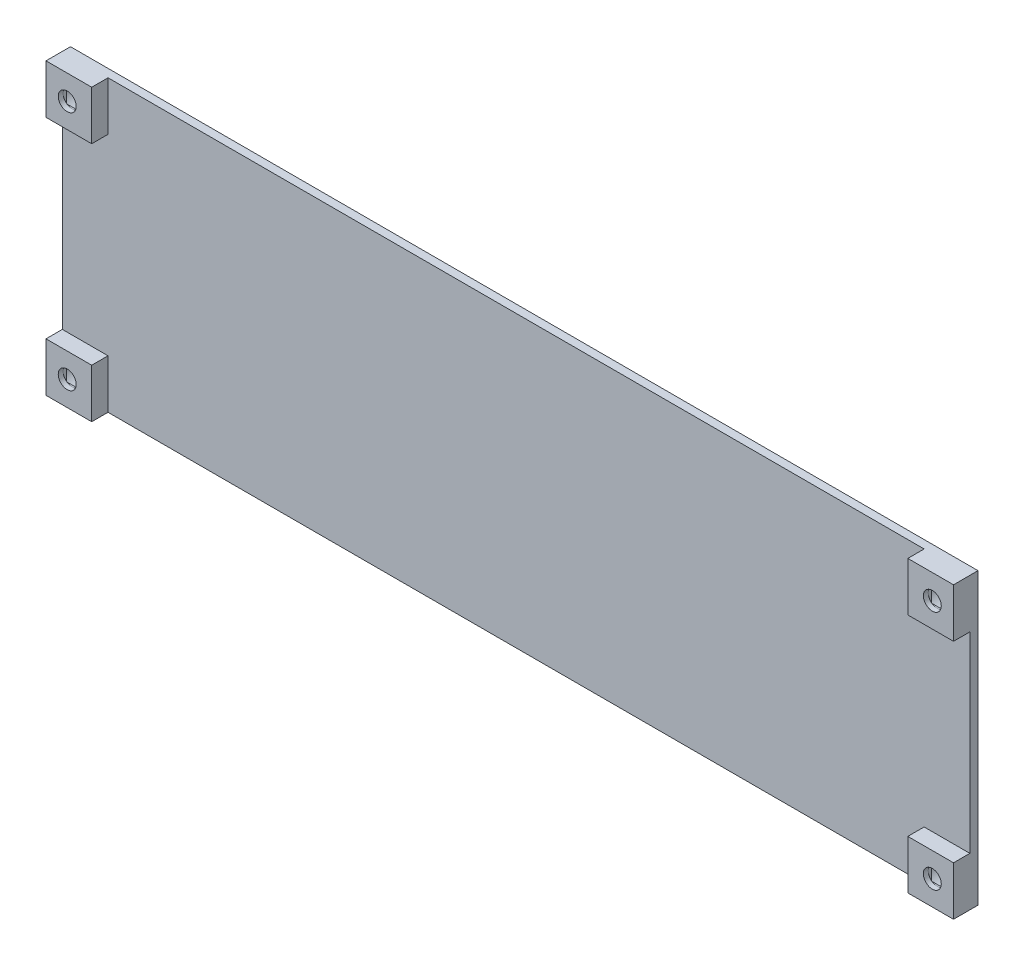
from build123d import *
from build123d.topology import SkipClean

# Parameters (mm, degrees)
SKETCH1_W               = 112
SKETCH1_H               = 35.5
BOSS_EXTRUDE1_DEPTH     = 1
SKETCH2_W               = 6
SKETCH2_H               = 6
BOSS_EXTRUDE2_DEPTH     = 2
SKETCH3_R               = 1.1
CUT_EXTRUDE1_DEPTH      = 59.822295943
SKETCH4_R               = 2
CUT_EXTRUDE2_DEPTH      = 2
CUT_EXTRUDE3_DEPTH      = 0.2
SKETCH6_W               = 2.2
SKETCH6_H               = 2.2
CUT_EXTRUDE4_DEPTH      = 0.2
MIRROR2_COPY_1_DEPTH    = 0.2
MIRROR2_COPY_2_SKETCH_W = 2.2
MIRROR2_COPY_2_SKETCH_H = 2.2
MIRROR2_COPY_2_DEPTH    = 0.2
SKETCH7_W               = 0.4
SKETCH7_H               = 35.5
CUT_EXTRUDE5_DEPTH      = 59.822295943


with BuildPart() as part:
    # Sketch1 → Boss-Extrude1 (new body)
    with BuildSketch(Plane.XY):
        Rectangle(SKETCH1_W, SKETCH1_H)
    extrude(amount=BOSS_EXTRUDE1_DEPTH)

    # Sketch2 → Boss-Extrude2 (add)
    with BuildSketch(Plane.XY.offset(1)):
        with Locations((-53, 14.75)):
            Rectangle(SKETCH2_W, SKETCH2_H)
        with Locations((-53, -14.75)):
            Rectangle(SKETCH2_W, SKETCH2_H)
        with Locations((53, -14.75)):
            Rectangle(SKETCH2_W, SKETCH2_H)
        with Locations((53, 14.75)):
            Rectangle(SKETCH2_W, SKETCH2_H)
    extrude(amount=BOSS_EXTRUDE2_DEPTH)

    # Sketch3 → Cut-Extrude1 (cut, through all)
    with BuildSketch(Plane.XY.offset(3)):
        with Locations((-53, 14.75)):
            Circle(SKETCH3_R)
        with Locations(Location((-53, -14.75, 0), (0, 0, 180))):
            Circle(SKETCH3_R)
        with Locations((53, -14.75)):
            Circle(SKETCH3_R)
        with Locations(Location((53, 14.75, 0), (0, 0, 180))):
            Circle(SKETCH3_R)
    extrude(amount=-CUT_EXTRUDE1_DEPTH, mode=Mode.SUBTRACT)

    # Sketch4 → Cut-Extrude2 (cut)
    with BuildSketch(Plane(origin=(0, 0, 0), x_dir=(-1, 0, 0), z_dir=(0, 0, -1))):
        with Locations((-53, 14.75)):
            Circle(SKETCH4_R)
        with Locations((-53, -14.75)):
            Circle(SKETCH4_R)
        with Locations((53, 14.75)):
            Circle(SKETCH4_R)
        with Locations((53, -14.75)):
            Circle(SKETCH4_R)
    extrude(amount=-CUT_EXTRUDE2_DEPTH, mode=Mode.SUBTRACT)

    # Sketch5 → Cut-Extrude3 (cut)
    with SkipClean():  # the faces are left unmerged after this step: merging them gives an invalid solid
        with BuildSketch(Plane(origin=(0, 0, 2), x_dir=(-1, 0, 0), z_dir=(0, 0, -1))):
            with BuildLine():
                Line((-54.1, 13.079670691), (-54.1, 16.420329309))
                ThreePointArc((-54.1, 16.420329309), (-53, 16.75), (-51.9, 16.420329309))
                Line((-51.9, 16.420329309), (-51.9, 13.079670691))
                ThreePointArc((-51.9, 13.079670691), (-53, 12.75), (-54.1, 13.079670691))
            make_face()
        cut_extrude3 = extrude(amount=-CUT_EXTRUDE3_DEPTH, mode=Mode.SUBTRACT)

    # Sketch6 → Cut-Extrude4 (cut)
    with SkipClean():  # the faces are left unmerged after this step: merging them gives an invalid solid
        with BuildSketch(Plane(origin=(0, 0, 2.2), x_dir=(-1, 0, 0), z_dir=(0, 0, -1))):
            with Locations((-53, 14.75)):
                Rectangle(SKETCH6_W, SKETCH6_H)
        cut_extrude4 = extrude(amount=-CUT_EXTRUDE4_DEPTH, mode=Mode.SUBTRACT)

    # Mirror1: Cut-Extrude3, Cut-Extrude4 across plane
    with SkipClean():  # the faces are left unmerged after this step: merging them gives an invalid solid
        add(cut_extrude3.mirror(Plane(origin=(0, 0, 0), x_dir=(0, 0, 1), z_dir=(1, 0, 0))), mode=Mode.SUBTRACT)
        add(cut_extrude4.mirror(Plane(origin=(0, 0, 0), x_dir=(0, 0, 1), z_dir=(1, 0, 0))), mode=Mode.SUBTRACT)

    # Mirror2: Cut-Extrude3, Cut-Extrude4 across plane
    with SkipClean():  # the faces are left unmerged after this step: merging them gives an invalid solid
        add(cut_extrude3.mirror(Plane.ZX), mode=Mode.SUBTRACT)
        add(cut_extrude4.mirror(Plane.ZX), mode=Mode.SUBTRACT)

    # Mirror2 copy 1 sketch → Mirror2 copy 1 (cut)
    with SkipClean():  # the faces are left unmerged after this step: merging them gives an invalid solid
        with BuildSketch(Plane(origin=(0, 0, 2), x_dir=(1, 0, 0), z_dir=(0, 0, -1))):
            with BuildLine():
                Line((-54.1, 13.079670691), (-54.1, 16.420329309))
                ThreePointArc((-54.1, 16.420329309), (-53, 16.75), (-51.9, 16.420329309))
                Line((-51.9, 16.420329309), (-51.9, 13.079670691))
                ThreePointArc((-51.9, 13.079670691), (-53, 12.75), (-54.1, 13.079670691))
            make_face()
        extrude(amount=-MIRROR2_COPY_1_DEPTH, mode=Mode.SUBTRACT)

    # Mirror2 copy 2 sketch → Mirror2 copy 2 (cut)
    with SkipClean():  # the faces are left unmerged after this step: merging them gives an invalid solid
        with BuildSketch(Plane(origin=(0, 0, 2.2), x_dir=(1, 0, 0), z_dir=(0, 0, -1))):
            with Locations((-53, 14.75)):
                Rectangle(MIRROR2_COPY_2_SKETCH_W, MIRROR2_COPY_2_SKETCH_H)
        extrude(amount=-MIRROR2_COPY_2_DEPTH, mode=Mode.SUBTRACT)

    # Sketch7 → Cut-Extrude5 (cut, through all)
    with SkipClean():  # the faces are left unmerged after this step: merging them gives an invalid solid
        with BuildSketch(Plane(origin=(0, 0, 0), x_dir=(-1, 0, 0), z_dir=(0, 0, -1))):
            with Locations((-55.8, 0)):
                Rectangle(SKETCH7_W, SKETCH7_H)
            with Locations((55.8, 0)):
                Rectangle(SKETCH7_W, SKETCH7_H)
        extrude(amount=-CUT_EXTRUDE5_DEPTH, mode=Mode.SUBTRACT)


solid = part.part
